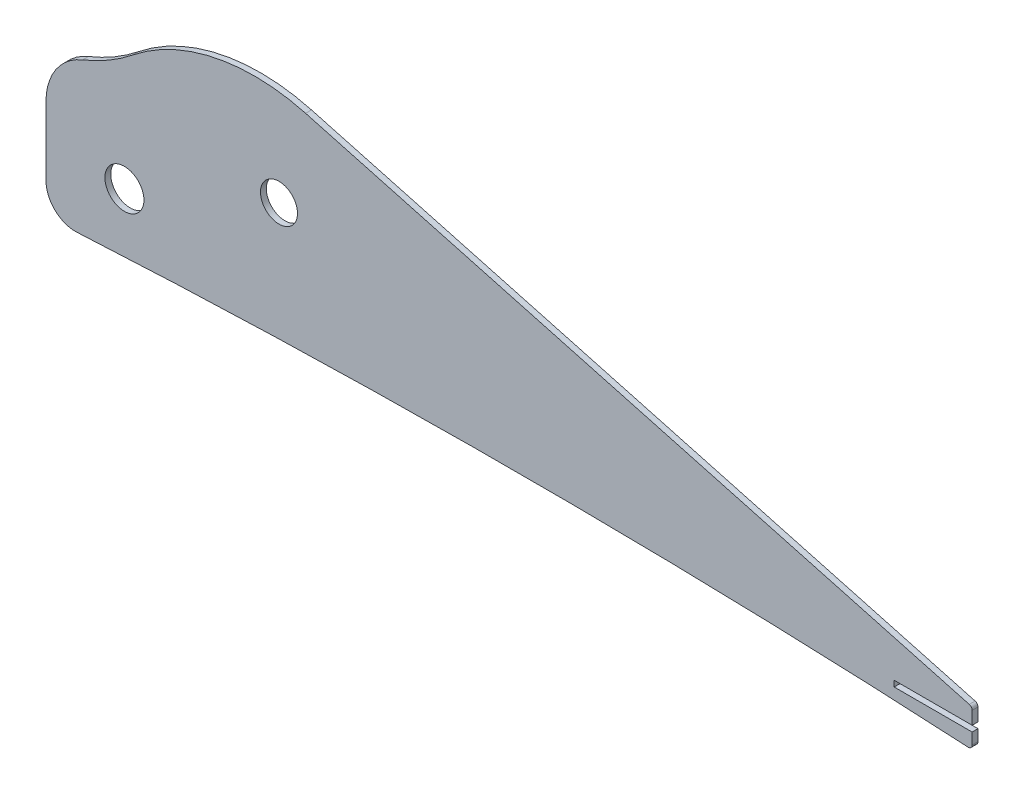
from build123d import *

# Parameters (mm, degrees)
BOSS_EXTRUDE1_DEPTH = 3
SKETCH2_R           = 9.5
CUT_EXTRUDE2_DEPTH  = 456.583037544
SKETCH6_W           = 40
SKETCH6_H           = 3
CUT_EXTRUDE4_DEPTH  = 456.583037544
SKETCH7_R           = 10
CUT_EXTRUDE5_DEPTH  = 10


with BuildPart() as part:
    # Sketch1 → Boss-Extrude1 (new body)
    with BuildSketch(Plane.XY):
        with BuildLine():
            Line((108.154123351, 67.552328068), (448.523707095, -24.796940542))
            ThreePointArc((448.523707095, -24.796940542), (449.588617983, -25.51212784), (450, -26.727155784))
            Line((450, -26.727155784), (450, -42.109493017))
            ThreePointArc((450, -42.109493017), (449.373989907, -43.562817391), (447.887848264, -44.106346038))
            ThreePointArc((447.887848264, -44.106346038), (219.361402367, -37.652818923), (-9.169620431, -43.942183392))
            ThreePointArc((-9.169620431, -43.942183392), (-20.308838598, -39.861416221), (-25, -28.96518537))
            Line((-25, -28.96518537), (-25, 6.26137734))
            ThreePointArc((-25, 6.26137734), (-19.871474725, 23.036649171), (-6.239350333, 34.076427296))
            ThreePointArc((-6.239350333, 34.076427296), (7.186208551, 40.672066088), (19.515669553, 49.14156866))
            ThreePointArc((19.515669553, 49.14156866), (61.632192327, 68.951849742), (108.154123351, 67.552328068))
        make_face()
    extrude(amount=BOSS_EXTRUDE1_DEPTH)

    # Sketch2 → Cut-Extrude2 (cut, through all)
    with BuildSketch(Plane.XY.offset(3)):
        with Locations((94.5, 21)):
            Circle(SKETCH2_R)
    extrude(amount=-CUT_EXTRUDE2_DEPTH, mode=Mode.SUBTRACT)

    # Sketch6 → Cut-Extrude4 (cut, through all)
    with BuildSketch(Plane.XY.offset(3)):
        with Locations((430, -34.843289866)):
            Rectangle(SKETCH6_W, SKETCH6_H)
    extrude(amount=-CUT_EXTRUDE4_DEPTH, mode=Mode.SUBTRACT)

    # Sketch7 → Cut-Extrude5 (cut)
    with BuildSketch(Plane.XY.offset(3)):
        with Locations((15.211776531, -12.474975597)):
            Circle(SKETCH7_R)
    extrude(amount=-CUT_EXTRUDE5_DEPTH, mode=Mode.SUBTRACT)


solid = part.part
